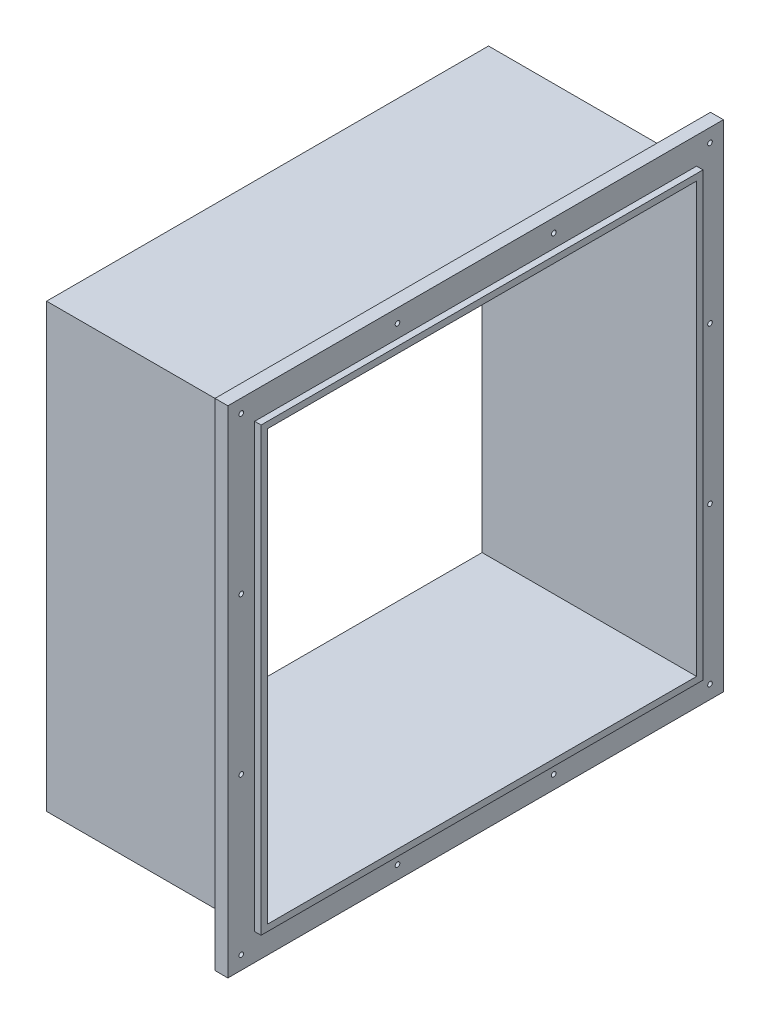
from build123d import *

# Parameters (mm, degrees)
SKETCH1_W           = 412
SKETCH1_H           = 412
SKETCH1_W_2         = 400
SKETCH1_H_2         = 400
EXTRUDE_THIN1_DEPTH = 200
SKETCH5_W           = 462
SKETCH5_H           = 462
SKETCH5_W_2         = 412
SKETCH5_H_2         = 412
EXTRUDE_THIN2_DEPTH = 12
SKETCH6_R           = 2.15
CUT_EXTRUDE1_DEPTH  = 380.944732823


with BuildPart() as part:
    # Sketch1 → Extrude-Thin1 (new body)
    with BuildSketch(Plane(origin=(0, 0, 0), x_dir=(0, 0, -1), z_dir=(1, 0, 0))):
        Rectangle(SKETCH1_W, SKETCH1_H)
        Rectangle(SKETCH1_W_2, SKETCH1_H_2, mode=Mode.SUBTRACT)
    extrude(amount=EXTRUDE_THIN1_DEPTH)

    # Sketch5 → Extrude-Thin2 (add)
    with BuildSketch(Plane(origin=(194, 0, 0), x_dir=(0, 0, -1), z_dir=(1, 0, 0))):
        Rectangle(SKETCH5_W, SKETCH5_H)
        Rectangle(SKETCH5_W_2, SKETCH5_H_2, mode=Mode.SUBTRACT)
    extrude(amount=-EXTRUDE_THIN2_DEPTH)

    # Sketch6 → Cut-Extrude1 (cut, through all)
    with BuildSketch(Plane(origin=(194, 0, 0), x_dir=(0, 0, -1), z_dir=(1, 0, 0))):
        with BuildLine():
            ThreePointArc((-216.35, 218.5), (-217.67723062, 220.486340995), (-220.02027958, 220.02027958))
            Line((-220.02027958, 220.02027958), (-216.97972042, 216.97972042))
            ThreePointArc((-216.97972042, 216.97972042), (-216.513659005, 217.67723062), (-216.35, 218.5))
        make_face()
        with BuildLine():
            Line((-216.97972042, 216.97972042), (-220.02027958, 220.02027958))
            ThreePointArc((-220.02027958, 220.02027958), (-220.02027958, 216.97972042), (-216.97972042, 216.97972042))
        make_face()
        with Locations((-72.83, 218.5)):
            Circle(SKETCH6_R)
        with Locations((72.84, 218.5)):
            Circle(SKETCH6_R)
        with Locations((-218.5, -72.84)):
            Circle(SKETCH6_R)
        with Locations((-72.83, -218.5)):
            Circle(SKETCH6_R)
        with Locations((72.84, -218.5)):
            Circle(SKETCH6_R)
        with Locations((218.5, -72.84)):
            Circle(SKETCH6_R)
        with Locations((-218.5, 72.83)):
            Circle(SKETCH6_R)
        with Locations((-218.5, -218.5)):
            Circle(SKETCH6_R)
        with Locations((218.5, -218.5)):
            Circle(SKETCH6_R)
        with Locations((218.5, 72.83)):
            Circle(SKETCH6_R)
        with Locations((218.5, 218.5)):
            Circle(SKETCH6_R)
    extrude(amount=-CUT_EXTRUDE1_DEPTH, mode=Mode.SUBTRACT)


solid = part.part
